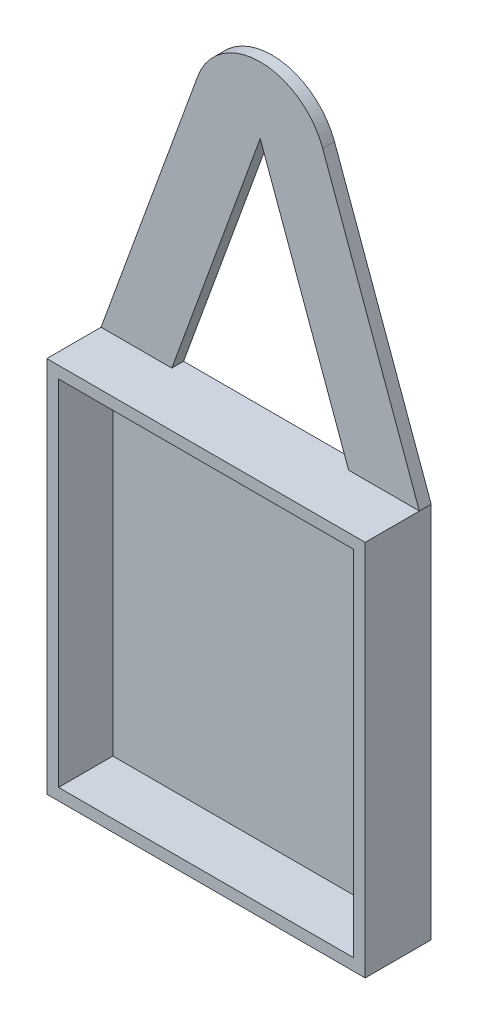
from build123d import *

# Parameters (mm, degrees)
BOSS_EXTRUDE1_DEPTH = 5
SKETCH2_W           = 135
SKETCH2_H           = 160
SKETCH2_W_2         = 125
SKETCH2_H_2         = 150
BOSS_EXTRUDE2_DEPTH = 23


with BuildPart() as part:
    # Sketch1 → Boss-Extrude1 (new body)
    with BuildSketch(Plane.XY):
        with BuildLine():
            Line((-67.5, 80), (-67.5, -80))
            Line((-67.5, -80), (67.5, -80))
            Line((67.5, -80), (67.5, 80))
            Line((67.5, 80), (26.490666647, 192.672217375))
            ThreePointArc((26.490666647, 192.672217375), (0, 211.221181853), (-26.490666647, 192.672217375))
            Line((-26.490666647, 192.672217375), (-67.5, 80))
        make_face()
        Polygon((-37.5, 80), (37.5, 80), (0, 183.03040323), align=None, mode=Mode.SUBTRACT)
    extrude(amount=BOSS_EXTRUDE1_DEPTH)

    # Sketch2 → Boss-Extrude2 (add)
    with BuildSketch(Plane.XY.offset(5)):
        Rectangle(SKETCH2_W, SKETCH2_H)
        Rectangle(SKETCH2_W_2, SKETCH2_H_2, mode=Mode.SUBTRACT)
    extrude(amount=BOSS_EXTRUDE2_DEPTH)


solid = part.part
